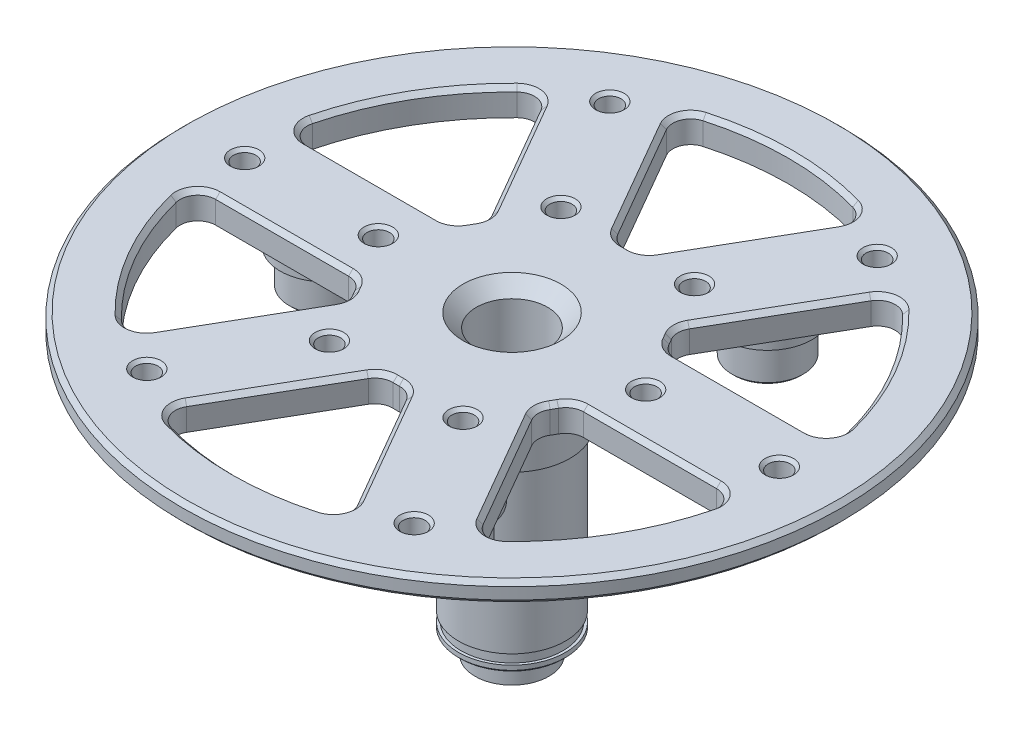
from build123d import *

# Parameters (mm, degrees)
CHAMFER1_SIZE                   = 0.5
CHAMFER2_SIZE                   = 0.25
CIRPATTERN1_COUNT               = 3
CHAMFER2_OF_CIRPATTERN1_SIZE    = 0.25
CHAMFER3_SIZE                   = 0.25
CHAMFER4_SIZE                   = 0.5
M3X0_5_TAPPED_HOLE1_D           = 2.5
M3X0_5_TAPPED_HOLE1_CSINK_D     = 3.2
M3X0_5_TAPPED_HOLE1_CSINK_ANGLE = 90
M3X0_5_TAPPED_HOLE2_D           = 2.5
M3X0_5_TAPPED_HOLE2_CSINK_D     = 3.2
M3X0_5_TAPPED_HOLE2_CSINK_ANGLE = 90
CIRPATTERN2_COUNT               = 6
CUT_EXTRUDE1_DEPTH              = 57.419943282
FILLET1_R                       = 2
CHAMFER5_SIZE                   = 0.5
CIRPATTERN3_COUNT               = 6
FILLET1_OF_CIRPATTERN3_R        = 2
CHAMFER5_OF_CIRPATTERN3_SIZE    = 0.5


with BuildPart() as part:
    # Sketch1 → Revolve1 (revolve)
    with BuildSketch(Plane.XY):
        Polygon((-3.15, -8.7), (-4, -8.7), (-4, 19.6), (-5.5, 21.1), (-37, 21.1), (-37, 18.8), (-32, 18.8), (-32, 18.1), (-6.5, 18.1), (-6.5, 10.15), (-6, 10.15), (-6, 5.15), (-6, 2.15), (-6, -7.85), (-5.7, -7.85), (-5.7, -8.95), (-6, -8.95), (-6, -9.7), (-4.15, -9.7), (-4.15, -12.2), (-3.15, -12.2), align=None)
    revolve(axis=Axis((0, 0, 0), (0, -1, 0)))

    # Chamfer1
    chamfer1_edges = [part.edges().sort_by_distance(p)[0] for p in [
        (3.15, -12.2, 0),
    ]]
    chamfer(chamfer1_edges, length=CHAMFER1_SIZE)

    # Sketch2 → Planet bearing axis (revolve)
    with BuildSketch(Plane.XY):
        Polygon((-21, 18.1), (-26, 18.1), (-26, 17.1), (-25, 17.1), (-25, 13), (-21, 13), align=None)
    planet_bearing_axis = revolve(axis=Axis((-21, 33.164090746, 0), (0, -1, 0)))

    # Chamfer2
    chamfer2_edges = [part.edges().sort_by_distance(p)[0] for p in [
        (-17, 13, 0),
    ]]
    chamfer(chamfer2_edges, length=CHAMFER2_SIZE)

    # CirPattern1: Planet bearing axis ×3 about axis
    cirpattern1_axis = Axis((0, 0, 0), (0, 1, 0))
    for i in range(1, CIRPATTERN1_COUNT):
        add(planet_bearing_axis.rotate(cirpattern1_axis, i * 360 / CIRPATTERN1_COUNT))

    # Chamfer2 of CirPattern1
    chamfer2_of_cirpattern1_edges = [part.edges().sort_by_distance(p)[0] for p in [
        (8.5, 13, 14.722431864),
        (8.5, 13, -14.722431864),
    ]]
    chamfer(chamfer2_of_cirpattern1_edges, length=CHAMFER2_OF_CIRPATTERN1_SIZE)

    # Chamfer3
    chamfer3_edges = [part.edges().sort_by_distance(p)[0] for p in [
        (6, -9.7, 0),
    ]]
    chamfer(chamfer3_edges, length=CHAMFER3_SIZE)

    # Chamfer4
    chamfer4_edges = [part.edges().sort_by_distance(p)[0] for p in [
        (37, 21.1, 0),
        (37, 18.8, 0),
        (6.5, 18.1, 0),
    ]]
    chamfer(chamfer4_edges, length=CHAMFER4_SIZE)

    # M3x0.5 Tapped Hole1 (through all)
    with Locations(Plane(origin=(0, 21.1, 0), x_dir=(1, 0, 0), z_dir=(0, 1, 0))):
        with Locations((-30, 0)):
            m3x0_5_tapped_hole1 = CounterSinkHole(M3X0_5_TAPPED_HOLE1_D / 2, M3X0_5_TAPPED_HOLE1_CSINK_D / 2, counter_sink_angle=M3X0_5_TAPPED_HOLE1_CSINK_ANGLE)

    # M3x0.5 Tapped Hole2 (through all)
    with Locations(Plane(origin=(0, 21.1, 0), x_dir=(1, 0, 0), z_dir=(0, 1, 0))):
        with Locations((-15, 0)):
            m3x0_5_tapped_hole2 = CounterSinkHole(M3X0_5_TAPPED_HOLE2_D / 2, M3X0_5_TAPPED_HOLE2_CSINK_D / 2, counter_sink_angle=M3X0_5_TAPPED_HOLE2_CSINK_ANGLE)

    # CirPattern2: M3x0.5 Tapped Hole1, M3x0.5 Tapped Hole2 ×6 about axis
    cirpattern2_axis = Axis((0, 0, 0), (0, 1, 0))
    add([m3x0_5_tapped_hole1.rotate(cirpattern2_axis, i * 360 / CIRPATTERN2_COUNT) for i in range(1, CIRPATTERN2_COUNT)], mode=Mode.SUBTRACT)
    add([m3x0_5_tapped_hole2.rotate(cirpattern2_axis, i * 360 / CIRPATTERN2_COUNT) for i in range(1, CIRPATTERN2_COUNT)], mode=Mode.SUBTRACT)

    # Sketch7 → Cut-Extrude1 (cut, through all)
    with BuildSketch(Plane(origin=(0, 0, 0), x_dir=(1, 0, 0), z_dir=(0, 1, 0))):
        with BuildLine():
            Line((-19.745135369, -23.898318544), (-10.428637185, -7.76167034))
            ThreePointArc((-10.428637185, -7.76167034), (-11.258330249, -6.5), (-11.936122283, -5.150629559))
            Line((-11.936122283, -5.150629559), (-30.569118652, -5.150629559))
            ThreePointArc((-30.569118652, -5.150629559), (-26.846787517, -15.5), (-19.745135369, -23.898318544))
        make_face()
    cut_extrude1 = extrude(amount=CUT_EXTRUDE1_DEPTH, mode=Mode.SUBTRACT)

    # Fillet1
    fillet1_edges = [part.edges().sort_by_distance(p)[0] for p in [
        (-19.745135369, 19.6, 23.898318544),
        (-30.569118652, 19.6, 5.150629559),
        (-10.428637185, 19.6, 7.76167034),
        (-11.936122283, 19.6, 5.150629559),
    ]]
    fillet(fillet1_edges, radius=FILLET1_R)

    # Chamfer5
    chamfer5_edges = [part.edges().sort_by_distance(p)[0] for p in [
        (-14.783205948, 21.1, 15.304004683),
        (-10.785765167, 21.1, 7.817335996),
        (-19.971331194, 21.1, 22.745180132),
        (-11.258330249, 21.1, 6.5),
        (-26.846787517, 21.1, 15.5),
        (-12.162894146, 21.1, 5.432078636),
        (-29.683569404, 21.1, 5.923090095),
        (-20.645259809, 21.1, 5.150629559),
    ]]
    chamfer(chamfer5_edges, length=CHAMFER5_SIZE)

    # CirPattern3: Cut-Extrude1 ×6 about axis
    cirpattern3_axis = Axis((0, 0, 0), (0, 1, 0))
    for i in range(1, CIRPATTERN3_COUNT):
        add(cut_extrude1.rotate(cirpattern3_axis, i * 360 / CIRPATTERN3_COUNT), mode=Mode.SUBTRACT)

    # Fillet1 of CirPattern3
    fillet1_of_cirpattern3_edges = [part.edges().sort_by_distance(p)[0] for p in [
        (10.823983283, 19.6, 29.048948103),
        (-10.823983283, 19.6, 29.048948103),
        (1.507485098, 19.6, 12.912299899),
        (-1.507485098, 19.6, 12.912299899),
        (30.569118652, 19.6, 5.150629559),
        (19.745135369, 19.6, 23.898318544),
        (11.936122283, 19.6, 5.150629559),
        (10.428637185, 19.6, 7.76167034),
        (19.745135369, 19.6, -23.898318544),
        (30.569118652, 19.6, -5.150629559),
        (10.428637185, 19.6, -7.76167034),
        (11.936122283, 19.6, -5.150629559),
        (-10.823983283, 19.6, -29.048948103),
        (10.823983283, 19.6, -29.048948103),
        (-1.507485098, 19.6, -12.912299899),
        (1.507485098, 19.6, -12.912299899),
        (-30.569118652, 19.6, -5.150629559),
        (-19.745135369, 19.6, -23.898318544),
        (-11.936122283, 19.6, -5.150629559),
        (-10.428637185, 19.6, -7.76167034),
    ]]
    fillet(fillet1_of_cirpattern3_edges, radius=FILLET1_OF_CIRPATTERN3_R)

    # Chamfer5 of CirPattern3
    chamfer5_of_cirpattern3_edges = [part.edges().sort_by_distance(p)[0] for p in [
        (5.862053861, 21.1, 20.454634241),
        (1.377128979, 21.1, 13.249414632),
        (9.712238211, 21.1, 28.668270227),
        (0, 21.1, 13),
        (0, 21.1, 31),
        (-1.377128979, 21.1, 13.249414632),
        (-9.712238211, 21.1, 28.668270227),
        (-5.862053861, 21.1, 20.454634241),
        (20.645259809, 21.1, 5.150629559),
        (12.162894146, 21.1, 5.432078636),
        (29.683569404, 21.1, 5.923090095),
        (11.258330249, 21.1, 6.5),
        (26.846787517, 21.1, 15.5),
        (10.785765167, 21.1, 7.817335996),
        (19.971331194, 21.1, 22.745180132),
        (14.783205948, 21.1, 15.304004683),
        (14.783205948, 21.1, -15.304004683),
        (10.785765167, 21.1, -7.817335996),
        (19.971331194, 21.1, -22.745180132),
        (11.258330249, 21.1, -6.5),
        (26.846787517, 21.1, -15.5),
        (12.162894146, 21.1, -5.432078636),
        (29.683569404, 21.1, -5.923090095),
        (20.645259809, 21.1, -5.150629559),
        (-5.862053861, 21.1, -20.454634241),
        (-1.377128979, 21.1, -13.249414632),
        (-9.712238211, 21.1, -28.668270227),
        (0, 21.1, -13),
        (0, 21.1, -31),
        (1.377128979, 21.1, -13.249414632),
        (9.712238211, 21.1, -28.668270227),
        (5.862053861, 21.1, -20.454634241),
        (-20.645259809, 21.1, -5.150629559),
        (-12.162894146, 21.1, -5.432078636),
        (-29.683569404, 21.1, -5.923090095),
        (-11.258330249, 21.1, -6.5),
        (-26.846787517, 21.1, -15.5),
        (-10.785765167, 21.1, -7.817335996),
        (-19.971331194, 21.1, -22.745180132),
        (-14.783205948, 21.1, -15.304004683),
    ]]
    chamfer(chamfer5_of_cirpattern3_edges, length=CHAMFER5_OF_CIRPATTERN3_SIZE)


solid = part.part
